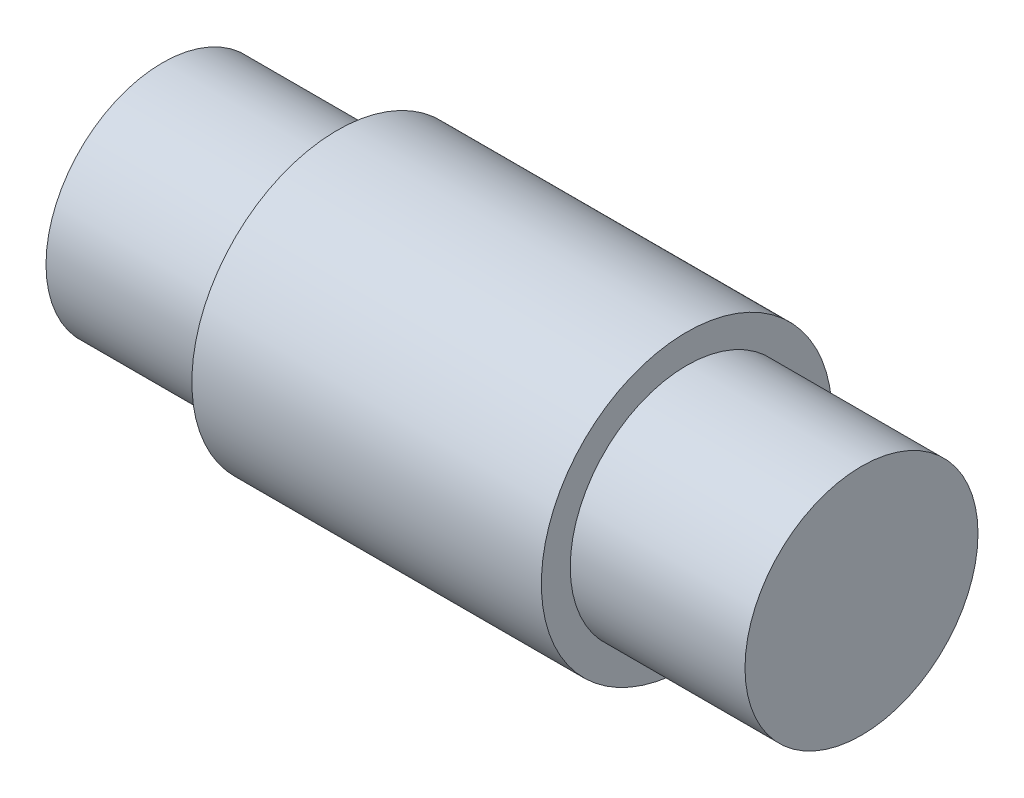
from build123d import *

# Parameters (mm, degrees)
SKETCH1_W = 4.7625
SKETCH1_H = 3.175


with BuildPart() as part:
    # Sketch1 → Revolve1 (revolve)
    with BuildSketch(Plane.XY, mode=Mode.PRIVATE) as revolve1_sk:
        with Locations((-7.14375, 1.5875)):
            Rectangle(SKETCH1_W, SKETCH1_H)
        Polygon((-4.7625, 0), (0, 0), (0, 3.9624), (-4.7625, 3.9624), (-4.7625, 3.175), align=None)
        Polygon((0, 3.9624), (0, 0), (4.7625, 0), (4.7625, 3.175), (4.7625, 3.9624), align=None)
        with Locations((7.14375, 1.5875)):
            Rectangle(SKETCH1_W, SKETCH1_H)
    revolve(revolve1_sk.sketch.rotate(Axis((0, 0, 0), (-1, 0, 0)), 90), axis=Axis((0, 0, 0), (-1, 0, 0)))


solid = part.part
